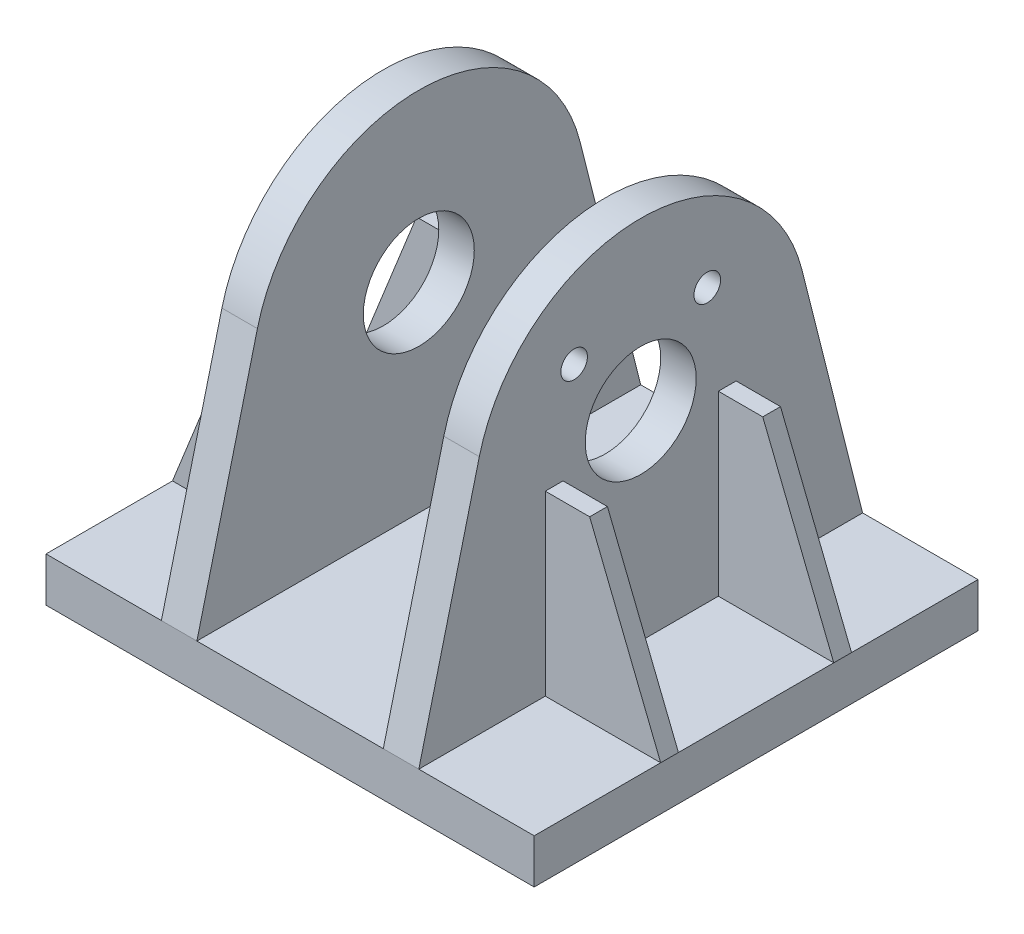
from build123d import *

# Parameters (mm, degrees)
SKETCH_1_W          = 220
SKETCH_1_H          = 200
EXTRUDE_1_DEPTH     = 20
SKETCH_2_W          = 16
SKETCH_2_H          = 200
EXTRUDE_2_DEPTH     = 200
SKETCH_3_R          = 25
CUT_EXTRUDE_1_DEPTH = 295.319554226
SKETCH_4_W          = 8
SKETCH_4_H          = 80
EXTRUDE_3_DEPTH     = 52
CUT_EXTRUDE_2_DEPTH = 259.406656261
SKETCH_6_R          = 6
CUT_EXTRUDE_3_DEPTH = 16


with BuildPart() as part:
    # 草图1 → 凸台-拉伸1 (new body)
    with BuildSketch(Plane(origin=(0, 0, 0), x_dir=(1, 0, 0), z_dir=(0, 1, 0))):
        Rectangle(SKETCH_1_W, SKETCH_1_H)
    extrude(amount=EXTRUDE_1_DEPTH)

    # 草图2 → 凸台-拉伸2 (add)
    with BuildSketch(Plane(origin=(0, 20, 0), x_dir=(1, 0, 0), z_dir=(0, 1, 0))):
        with Locations((-50, 0)):
            Rectangle(SKETCH_2_W, SKETCH_2_H)
        with Locations((50, 0)):
            Rectangle(SKETCH_2_W, SKETCH_2_H)
    extrude(amount=EXTRUDE_2_DEPTH)

    # 草图3 → 切除-拉伸1 (cut, through all)
    with BuildSketch(Plane(origin=(58, 0, 0), x_dir=(0, 0, -1), z_dir=(1, 0, 0))):
        with Locations((0, 110)):
            Circle(SKETCH_3_R)
        with BuildLine():
            Line((-72.730270262, 128.311411403), (-100, 20))
            Line((-100, 20), (-100, 220))
            Line((-100, 220), (100, 220))
            Line((100, 220), (100, 20))
            Line((100, 20), (72.730270262, 128.311411403))
            ThreePointArc((72.730270262, 128.311411403), (0, 185), (-72.730270262, 128.311411403))
        make_face()
    extrude(amount=-CUT_EXTRUDE_1_DEPTH, mode=Mode.SUBTRACT)

    # 草图4 → 凸台-拉伸3 (add)
    with BuildSketch(Plane(origin=(58, 0, 0), x_dir=(0, 0, -1), z_dir=(1, 0, 0))):
        with Locations((-39, 60)):
            Rectangle(SKETCH_4_W, SKETCH_4_H)
        with Locations((39, 60)):
            Rectangle(SKETCH_4_W, SKETCH_4_H)
    extrude_3 = extrude(amount=EXTRUDE_3_DEPTH)

    # 草图5 → 切除-拉伸2 (cut, through all)
    with BuildSketch(Plane.XY.offset(43)):
        Polygon((110, 100), (78, 100), (110, 20), align=None)
    cut_extrude_2 = extrude(amount=-CUT_EXTRUDE_2_DEPTH, mode=Mode.SUBTRACT)

    # 镜向1: 凸台-拉伸3, 切除-拉伸2 across plane
    add(extrude_3.mirror(Plane(origin=(0, 0, 0), x_dir=(0, 0, 1), z_dir=(1, 0, 0))))
    add(cut_extrude_2.mirror(Plane(origin=(0, 0, 0), x_dir=(0, 0, 1), z_dir=(1, 0, 0))), mode=Mode.SUBTRACT)

    # 草图6 → 切除-拉伸3 (cut)
    with BuildSketch(Plane(origin=(58, 0, 0), x_dir=(0, 0, -1), z_dir=(1, 0, 0))):
        with Locations((-30, 143)):
            Circle(SKETCH_6_R)
        with Locations((30, 143)):
            Circle(SKETCH_6_R)
    extrude(amount=-CUT_EXTRUDE_3_DEPTH, mode=Mode.SUBTRACT)


solid = part.part
